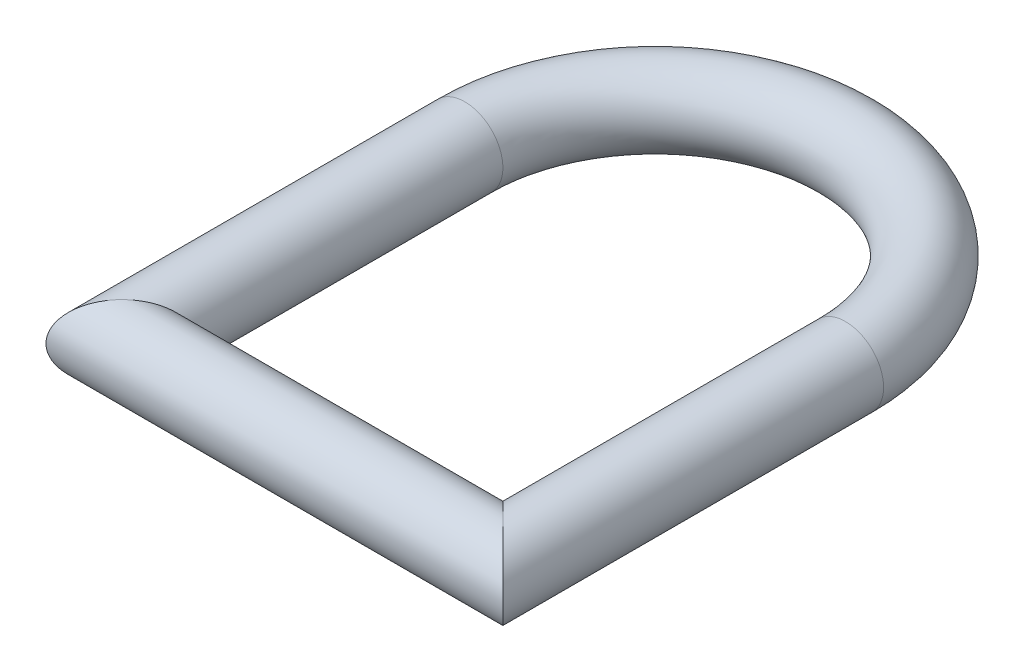
from build123d import *

# Parameters (mm, degrees)
SKETCH_1_R          = 50
SKETCH_1_R_2        = 47.5
CUT_EXTRUDE_1_DEPTH = 150
SKETCH_3_R          = 50
SKETCH_3_R_2        = 47.5
EXTRUDE_1_DEPTH     = 350
SKETCH_5_R          = 50
SKETCH_5_R_2        = 47.5


with BuildPart() as part:
    # 草图1 → 旋转1 (revolve)
    with BuildSketch(Plane.XY, mode=Mode.PRIVATE) as revolve_1_sk:
        with Locations((250, 0)):
            Circle(SKETCH_1_R)
        with Locations((250, 0)):
            Circle(SKETCH_1_R_2, mode=Mode.SUBTRACT)
    revolve(revolve_1_sk.sketch.rotate(Axis((0, 0, 0), (0, 1, 0)), 90), axis=Axis((0, 0, 0), (0, 1, 0)))

    # 草图2 → 切除-拉伸1 (cut, symmetric)
    with BuildSketch(Plane(origin=(0, 0, 0), x_dir=(1, 0, 0), z_dir=(0, 1, 0))):
        Polygon((-384.261644324, 0), (443.109902211, 0), (321.917450325, -325.996042455), (-266.565128549, -318.421514212), align=None)
    extrude(amount=CUT_EXTRUDE_1_DEPTH, both=True, mode=Mode.SUBTRACT)

    # 草图3 → 凸台-拉伸1 (add)
    with BuildSketch(Plane.XY):
        with Locations((250, 0)):
            Circle(SKETCH_3_R)
        with Locations((250, 0)):
            Circle(SKETCH_3_R_2, mode=Mode.SUBTRACT)
    extrude_1 = extrude(amount=EXTRUDE_1_DEPTH)

    # 镜向1: 凸台-拉伸1 across plane
    add(extrude_1.mirror(Plane(origin=(0, 0, 0), x_dir=(0, 0, 1), z_dir=(1, 0, 0))))

    # 扫描1: sweep along a path in 草图4
    with BuildLine(Plane(origin=(0, 0, 0), x_dir=(1, 0, 0), z_dir=(0, 1, 0))) as sweep_1_path:
        Line((250, -350), (250, -450))
        Line((250, -450), (0, -450))
    # 草图5 → 扫描1 (sweep)
    with BuildSketch(Plane.XY.offset(350)):
        with Locations((250, 0)):
            Circle(SKETCH_5_R)
        with Locations((250, 0)):
            Circle(SKETCH_5_R_2, mode=Mode.SUBTRACT)
    sweep_1 = sweep(path=sweep_1_path.line, transition=Transition.RIGHT)

    # 镜向2: 扫描1 across plane
    add(sweep_1.mirror(Plane(origin=(0, 0, 0), x_dir=(0, 0, 1), z_dir=(1, 0, 0))))


solid = part.part
